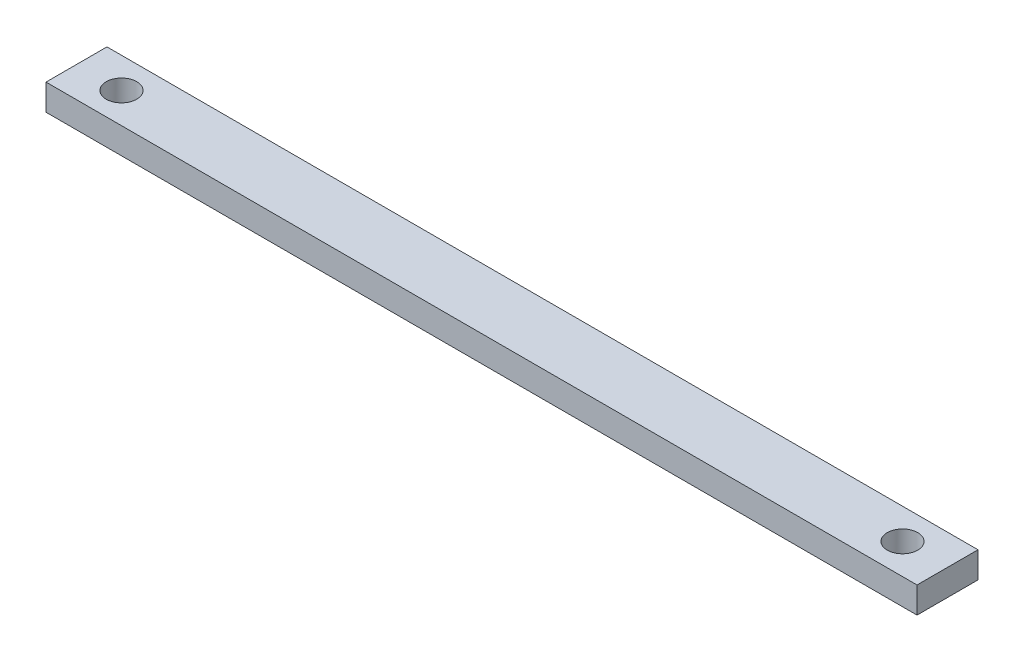
from build123d import *

# Parameters (mm, degrees)
ESQUISSE1_W             = 600
ESQUISSE1_H             = 42
BOSS_EXTRU_1_DEPTH      = 18
ESQUISSE2_R             = 10.5
ENL_V_MAT_EXTRU_1_DEPTH = 20


with BuildPart() as part:
    # Esquisse1 → Boss.-Extru.1 (new body)
    with BuildSketch(Plane(origin=(0, 0, 0), x_dir=(1, 0, 0), z_dir=(0, 1, 0))):
        Rectangle(ESQUISSE1_W, ESQUISSE1_H)
    extrude(amount=BOSS_EXTRU_1_DEPTH)

    # Esquisse2 → Enlèv. mat.-Extru.1 (cut)
    with BuildSketch(Plane(origin=(0, 18, 0), x_dir=(1, 0, 0), z_dir=(0, 1, 0))):
        with Locations(Location((269, 0, 0), (0, 0, 270))):
            Circle(ESQUISSE2_R)
        with Locations(Location((-269, 0, 0), (0, 0, 270))):
            Circle(ESQUISSE2_R)
    extrude(amount=-ENL_V_MAT_EXTRU_1_DEPTH, mode=Mode.SUBTRACT)


solid = part.part
